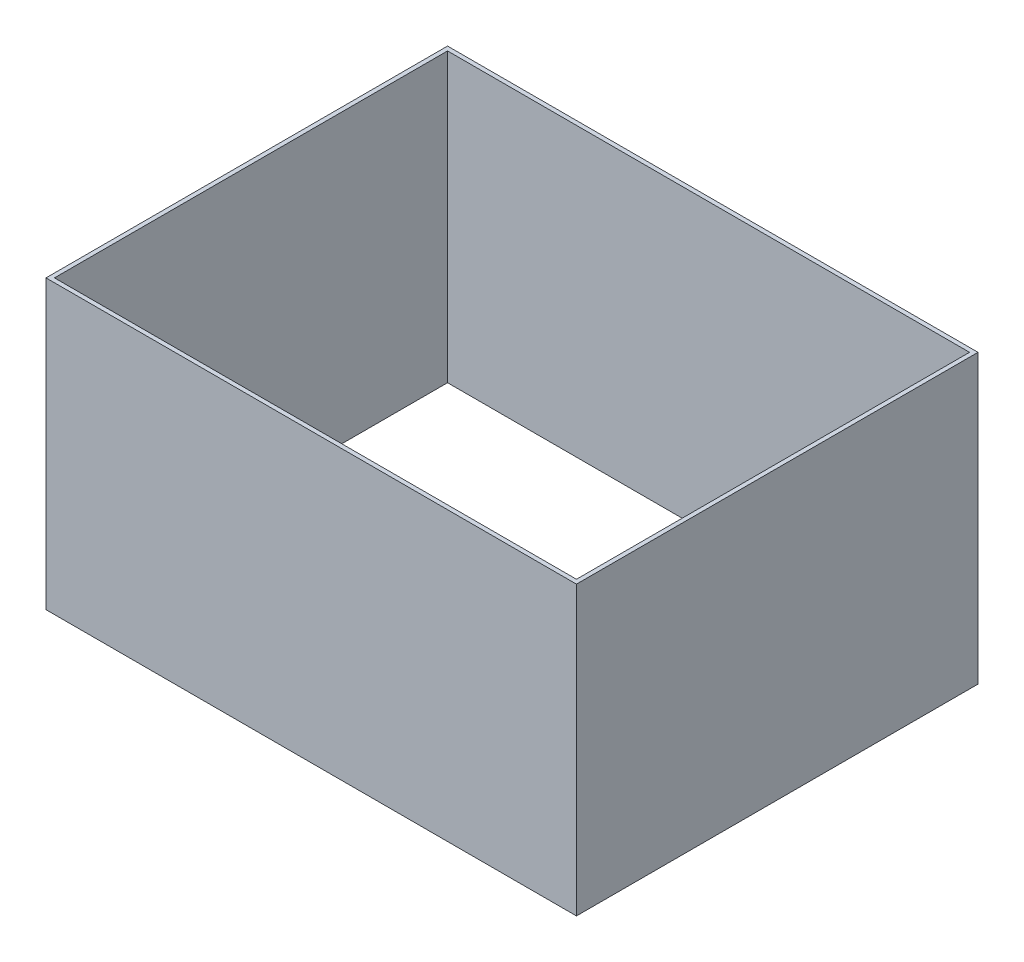
from build123d import *

# Parameters (mm, degrees)
SKETCH_1_W      = 2510
SKETCH_1_H      = 1900
SKETCH_1_W_2    = 2470
SKETCH_1_H_2    = 1860
EXTRUDE_1_DEPTH = 1359.75


with BuildPart() as part:
    # Эскиз1 → Выдавливание1 (new body)
    with BuildSketch(Plane(origin=(0, 0, 0), x_dir=(-1, 0, 0), z_dir=(0, 1, 0))):
        with Locations((-390.386996904, -60.030930247)):
            Rectangle(SKETCH_1_W, SKETCH_1_H)
        with Locations((-390.386996904, -60.030930247)):
            Rectangle(SKETCH_1_W_2, SKETCH_1_H_2, mode=Mode.SUBTRACT)
    extrude(amount=EXTRUDE_1_DEPTH)


solid = part.part
